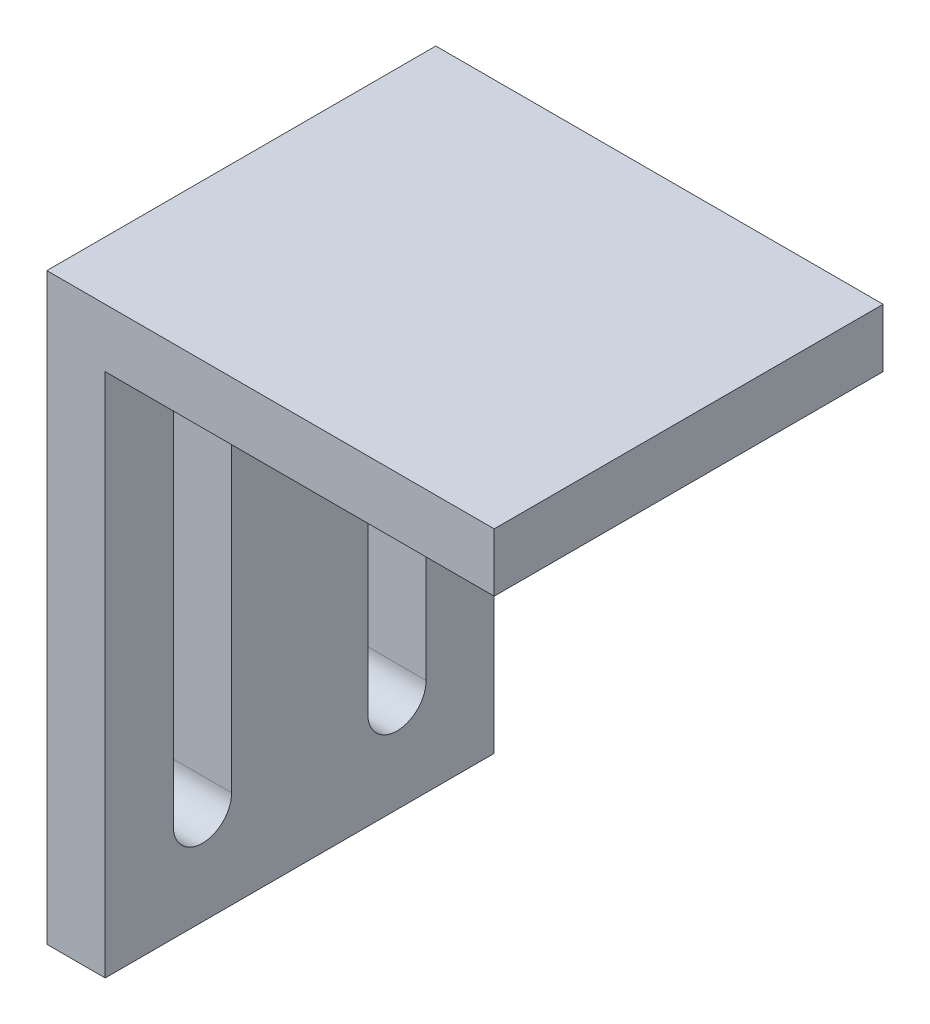
from build123d import *

# Parameters (mm, degrees)
SKETCH1_W           = 20
SKETCH1_H           = 30
BOSS_EXTRUDE1_DEPTH = 3
SKETCH2_W           = 20
SKETCH2_H           = 3
BOSS_EXTRUDE2_DEPTH = 20


with BuildPart() as part:
    # Sketch1 → Boss-Extrude1 (new body)
    with BuildSketch(Plane(origin=(0, 0, 0), x_dir=(0, 0, -1), z_dir=(1, 0, 0))):
        Rectangle(SKETCH1_W, SKETCH1_H)
        with BuildLine():
            Line((-3.5, 10), (-3.5, -10))
            ThreePointArc((-3.5, -10), (-5, -11.5), (-6.5, -10))
            Line((-6.5, -10), (-6.5, 10))
            ThreePointArc((-6.5, 10), (-5, 11.5), (-3.5, 10))
        make_face(mode=Mode.SUBTRACT)
        with BuildLine():
            Line((6.5, 10), (6.5, -10))
            ThreePointArc((6.5, -10), (5, -11.5), (3.5, -10))
            Line((3.5, -10), (3.5, 10))
            ThreePointArc((3.5, 10), (5, 11.5), (6.5, 10))
        make_face(mode=Mode.SUBTRACT)
    extrude(amount=BOSS_EXTRUDE1_DEPTH)

    # Sketch2 → Boss-Extrude2 (add)
    with BuildSketch(Plane(origin=(3, 0, 0), x_dir=(0, 0, -1), z_dir=(1, 0, 0))):
        with Locations((0, 13.5)):
            Rectangle(SKETCH2_W, SKETCH2_H)
    extrude(amount=BOSS_EXTRUDE2_DEPTH)


solid = part.part
